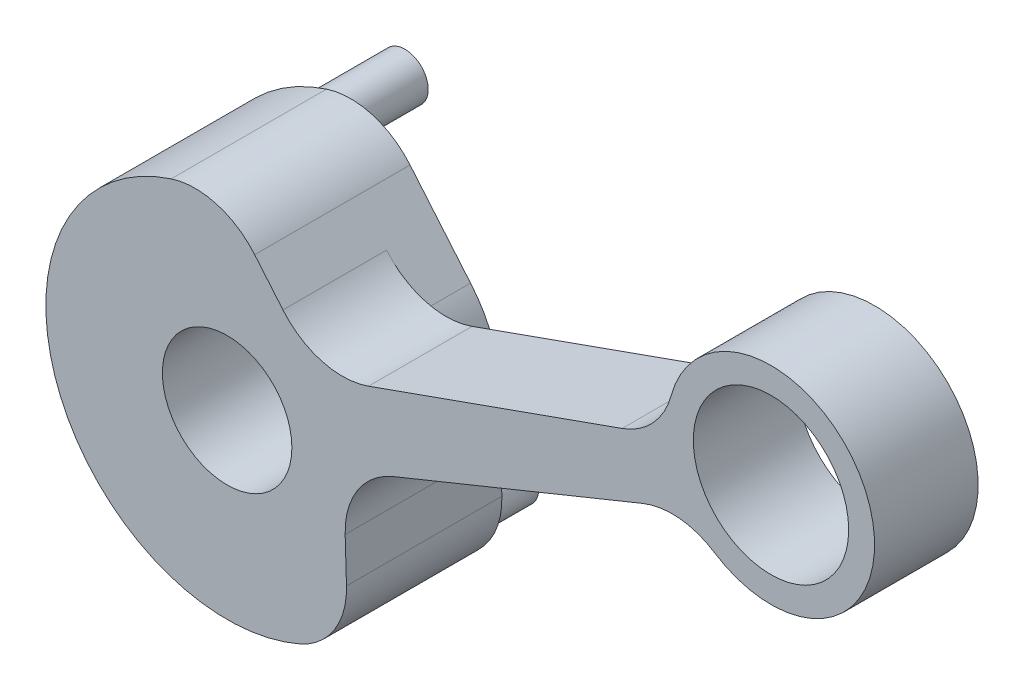
from build123d import *

# Parameters (mm, degrees)
SKETCH1_R           = 3
BOSS_EXTRUDE1_DEPTH = 4
FILLET1_R           = 3
FILLET2_R           = 3
BOSS_EXTRUDE2_START = -2
BOSS_EXTRUDE2_DEPTH = 2
SKETCH2_R           = 2.5
CUT_EXTRUDE1_DEPTH  = 29.372521918
SKETCH4_R           = 0.9
BOSS_EXTRUDE3_DEPTH = 3


with BuildPart() as part:
    # Sketch1 → Boss-Extrude1 (new body)
    with BuildSketch(Plane.XY):
        with BuildLine():
            Line((4.495140924, 0.209064756), (17.788851391, 5.614937189))
            ThreePointArc((17.788851391, 5.614937189), (24.73795094, 9.42398131), (17.01587301, 7.64400544))
            Line((17.01587301, 7.64400544), (3.494878983, 2.834752351))
            Line((3.494878983, 2.834752351), (1.063186177, 5.732879237))
            ThreePointArc((1.063186177, 5.732879237), (-0.407640956, 6.688232403), (-2.161242517, 6.658005015))
            ThreePointArc((-2.161242517, 6.658005015), (-6.541414145, -2.491967293), (2.816438132, -6.408406686))
            ThreePointArc((2.816438132, -6.408406686), (4.145674153, -5.264219757), (4.608056658, -3.572405775))
            Line((4.608056658, -3.572405775), (4.495140924, 0.209064756))
        make_face()
        with Locations((21, 8)):
            Circle(SKETCH1_R, mode=Mode.SUBTRACT)
    extrude(amount=BOSS_EXTRUDE1_DEPTH)

    # Fillet1
    fillet1_edges = [part.edges().sort_by_distance(p)[0] for p in [
        (3.494878983, 2.834752351, 2),
        (4.495140924, 0.209064756, 2),
    ]]
    fillet(fillet1_edges, radius=FILLET1_R)

    # Fillet2
    fillet2_edges = [part.edges().sort_by_distance(p)[0] for p in [
        (17.788851391, 5.614937189, 2),
        (17.01587301, 7.64400544, 2),
    ]]
    fillet(fillet2_edges, radius=FILLET2_R)

    # Sketch1<3> → Boss-Extrude2 (add)
    with BuildSketch(Plane.XY.offset(BOSS_EXTRUDE2_START)):
        with BuildLine():
            Line((3.398714044, 2.949363125), (1.063186177, 5.732879237))
            ThreePointArc((1.063186177, 5.732879237), (-0.407640956, 6.688232403), (-2.161242517, 6.658005015))
            ThreePointArc((-2.161242517, 6.658005015), (-6.541414145, -2.491967293), (2.816438132, -6.408406686))
            ThreePointArc((2.816438132, -6.408406686), (4.145674153, -5.264219757), (4.608056658, -3.572405775))
            Line((4.608056658, -3.572405775), (4.499606346, 0.059520833))
            ThreePointArc((4.499606346, 0.059520833), (4.205194807, 1.601978974), (3.398714044, 2.949363125))
        make_face()
    extrude(amount=BOSS_EXTRUDE2_DEPTH)

    # Sketch2 → Cut-Extrude1 (cut, through all)
    with BuildSketch(Plane.XY.offset(4)):
        Circle(SKETCH2_R)
    extrude(amount=-CUT_EXTRUDE1_DEPTH, mode=Mode.SUBTRACT)

    # Sketch4 → Boss-Extrude3 (add)
    with BuildSketch(Plane.XY.offset(-2)):
        with Locations((-2.135971966, 5.60692641)):
            Circle(SKETCH4_R)
        with Locations((2.135971966, -5.60692641)):
            Circle(SKETCH4_R)
        with Locations((-5.60692641, -2.135971966)):
            Circle(SKETCH4_R)
    extrude(amount=-BOSS_EXTRUDE3_DEPTH)


solid = part.part
